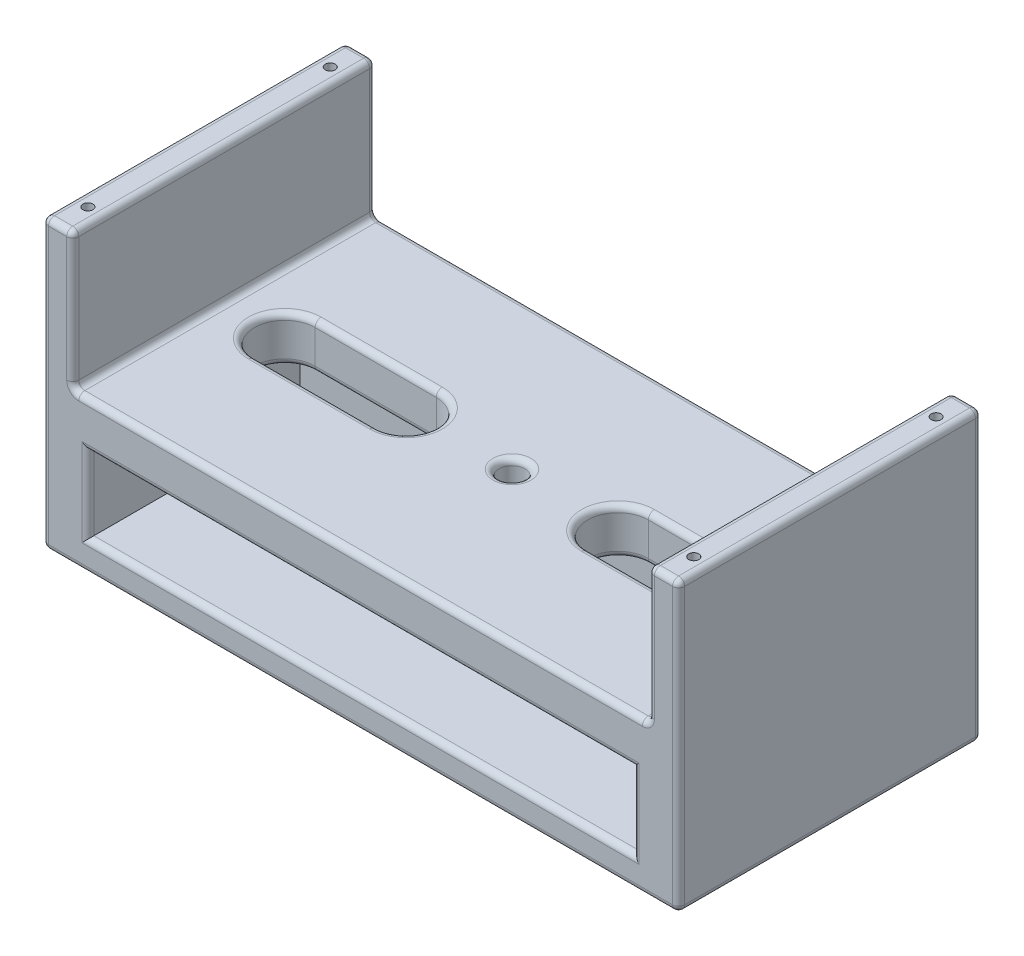
from build123d import *

# Parameters (mm, degrees)
SKETCH_1_W          = 210
SKETCH_1_H          = 100
EXTRUDE_1_DEPTH     = 50
CUT_EXTRUDE_1_DEPTH = 40
SKETCH_3_W          = 180
SKETCH_3_H          = 25
CUT_EXTRUDE_2_DEPTH = 70
SKETCH_4_R          = 4.25
CUT_EXTRUDE_3_DEPTH = 20
FILLET_4_R          = 2
SKETCH_6_W          = 10
SKETCH_6_H          = 100
EXTRUDE_2_DEPTH     = 45
FILLET_7_R          = 2
SKETCH_7_R          = 1.65
CUT_EXTRUDE_4_DEPTH = 8


with BuildPart() as part:
    # 草图1 → 凸台-拉伸1 (new body)
    with BuildSketch(Plane(origin=(0, 0, 0), x_dir=(1, 0, 0), z_dir=(0, 1, 0))):
        with Locations((105, -50)):
            Rectangle(SKETCH_1_W, SKETCH_1_H)
    extrude(amount=EXTRUDE_1_DEPTH)

    # 草图2 → 切除-拉伸1 (cut)
    with BuildSketch(Plane(origin=(0, 50, 0), x_dir=(1, 0, 0), z_dir=(0, 1, 0))):
        with BuildLine():
            Line((30, -40), (70, -40))
            ThreePointArc((70, -40), (80, -50), (70, -60))
            Line((70, -60), (30, -60))
            ThreePointArc((30, -60), (20, -50), (30, -40))
        make_face()
        with BuildLine():
            Line((140, -40), (180, -40))
            ThreePointArc((180, -40), (190, -50), (180, -60))
            Line((180, -60), (140, -60))
            ThreePointArc((140, -60), (130, -50), (140, -40))
        make_face()
    extrude(amount=-CUT_EXTRUDE_1_DEPTH, mode=Mode.SUBTRACT)

    # 草图3 → 切除-拉伸2 (cut)
    with BuildSketch(Plane.XY.offset(100)):
        with Locations((105, 22.5)):
            Rectangle(SKETCH_3_W, SKETCH_3_H)
    extrude(amount=-CUT_EXTRUDE_2_DEPTH, mode=Mode.SUBTRACT)

    # 草图4 → 切除-拉伸3 (cut)
    with BuildSketch(Plane(origin=(0, 50, 0), x_dir=(1, 0, 0), z_dir=(0, 1, 0))):
        with Locations(Location((105, -50, 0), (0, 0, 270))):
            Circle(SKETCH_4_R)
    extrude(amount=-CUT_EXTRUDE_3_DEPTH, mode=Mode.SUBTRACT)

    # 圆角4
    fillet_4_edges = [part.edges().sort_by_distance(p)[0] for p in [
        (20, 50, 50),
        (50, 50, 60),
        (80, 50, 50),
        (50, 50, 40),
        (130, 50, 50),
        (160, 50, 60),
        (190, 50, 50),
        (160, 50, 40),
        (50, 35, 60),
        (20, 35, 50),
        (50, 35, 40),
        (80, 35, 50),
        (160, 35, 60),
        (130, 35, 50),
        (160, 35, 40),
        (190, 35, 50),
        (105, 35, 45.75),
        (105, 50, 45.75),
    ]]
    fillet(fillet_4_edges, radius=FILLET_4_R)

    # 草图6 → 凸台-拉伸2 (add)
    with BuildSketch(Plane(origin=(0, 50, 0), x_dir=(1, 0, 0), z_dir=(0, 1, 0))):
        with Locations((205, -50)):
            Rectangle(SKETCH_6_W, SKETCH_6_H)
        with Locations((5, -50)):
            Rectangle(SKETCH_6_W, SKETCH_6_H)
    extrude(amount=EXTRUDE_2_DEPTH)

    # 圆角7
    fillet_7_edges = [part.edges().sort_by_distance(p)[0] for p in [
        (105, 50, 100),
        (10, 50, 50),
        (10, 72.5, 100),
        (10, 72.5, 0),
        (0, 95, 50),
        (5, 95, 100),
        (10, 95, 50),
        (5, 95, 0),
        (105, 50, 0),
        (200, 50, 50),
        (200, 72.5, 0),
        (200, 72.5, 100),
        (210, 95, 50),
        (205, 95, 0),
        (200, 95, 50),
        (205, 95, 100),
        (105, 0, 0),
        (15, 22.5, 100),
        (105, 10, 100),
        (210, 0, 50),
        (195, 22.5, 100),
        (105, 35, 100),
        (105, 0, 100),
        (0, 0, 50),
        (0, 47.5, 0),
        (210, 47.5, 0),
        (210, 47.5, 100),
        (0, 47.5, 100),
    ]]
    fillet(fillet_7_edges, radius=FILLET_7_R)

    # 草图7 → 切除-拉伸4 (cut)
    with BuildSketch(Plane(origin=(0, 95, 0), x_dir=(1, 0, 0), z_dir=(0, 1, 0))):
        with Locations(Location((5, -10, 0), (0, 0, 270))):
            Circle(SKETCH_7_R)
        with Locations(Location((5, -90, 0), (0, 0, 270))):
            Circle(SKETCH_7_R)
        with Locations(Location((205, -90, 0), (0, 0, 270))):
            Circle(SKETCH_7_R)
        with Locations(Location((205, -10, 0), (0, 0, 270))):
            Circle(SKETCH_7_R)
    extrude(amount=-CUT_EXTRUDE_4_DEPTH, mode=Mode.SUBTRACT)


solid = part.part
